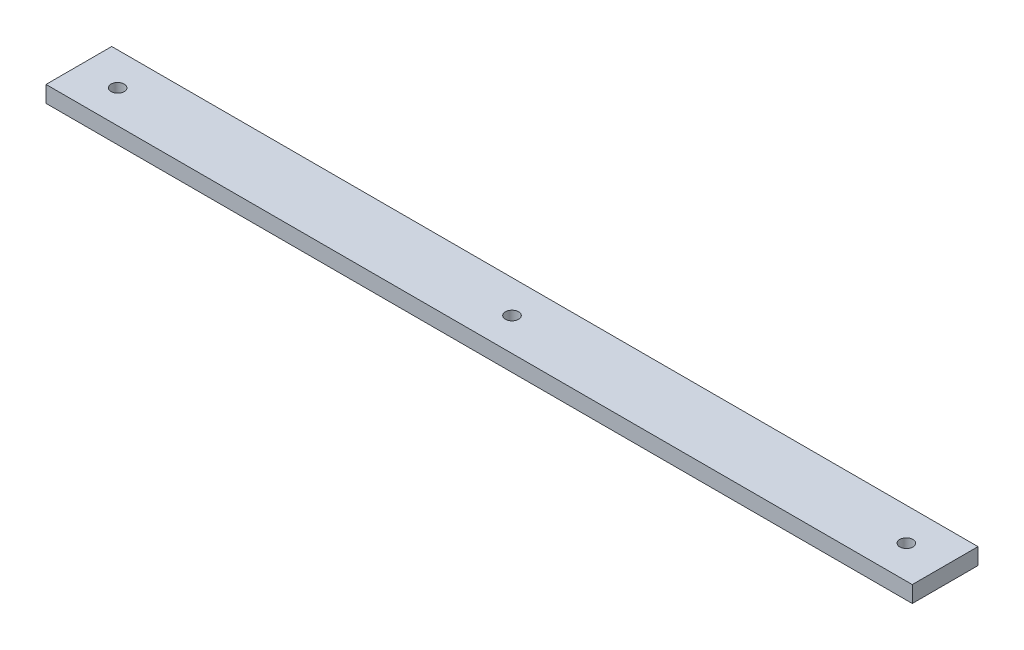
from build123d import *

# Parameters (mm, degrees)
SKETCH1_4_W         = 263.6
SKETCH1_4_H         = 20
SKETCH1_4_R         = 2
BOSS_EXTRUDE3_DEPTH = 5


with BuildPart() as part:
    # Sketch1<4> → Boss-Extrude3 (new body)
    with BuildSketch(Plane(origin=(0, 0, 0), x_dir=(1, 0, 0), z_dir=(0, 1, 0))):
        Rectangle(SKETCH1_4_W, SKETCH1_4_H)
        with Locations((-120, 0)):
            Circle(SKETCH1_4_R, mode=Mode.SUBTRACT)
        Circle(SKETCH1_4_R, mode=Mode.SUBTRACT)
        with Locations((120, 0)):
            Circle(SKETCH1_4_R, mode=Mode.SUBTRACT)
    extrude(amount=BOSS_EXTRUDE3_DEPTH)


solid = part.part
